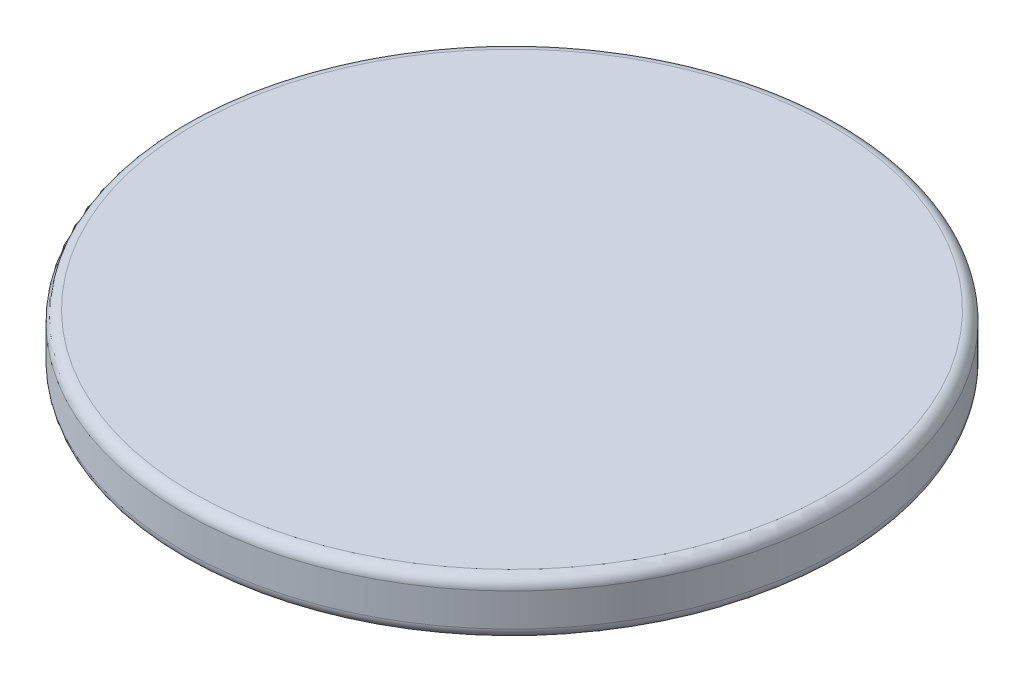
from build123d import *

# Parameters (mm, degrees)
SKETCH1_R           = 228.6
BOSS_EXTRUDE1_DEPTH = 38.1
FILLET1_R           = 7.62


with BuildPart() as part:
    # Sketch1 → Boss-Extrude1 (new body)
    with BuildSketch(Plane(origin=(0, 0, 0), x_dir=(1, 0, 0), z_dir=(0, 1, 0))):
        with Locations(Location((0, 0, 0), (0, 0, 90))):
            Circle(SKETCH1_R)
    extrude(amount=BOSS_EXTRUDE1_DEPTH)

    # Fillet1
    fillet1_edges = [part.edges().sort_by_distance(p)[0] for p in [
        (0, 0, 228.6),
        (0, 38.1, 228.6),
    ]]
    fillet(fillet1_edges, radius=FILLET1_R)


solid = part.part
